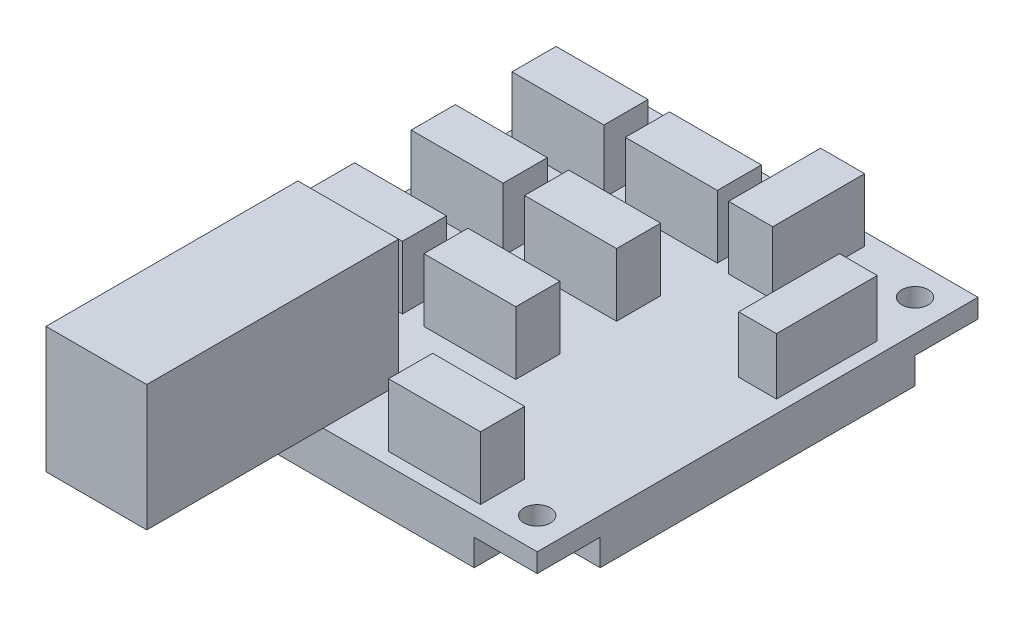
from build123d import *

# Parameters (mm, degrees)
SKETCH_1_W                       = 30
SKETCH_1_H                       = 35
EXTRUDE_1_DEPTH                  = 0.75
SKETCH_2_R                       = 1.05
CUT_EXTRUDE_1_DEPTH              = 1.5
EXTRUDE_2_DEPTH                  = 2.1
SKETCH_4_W                       = 3.5
SKETCH_4_H                       = 7.3
SKETCH_4_W_2                     = 7.3
SKETCH_4_H_2                     = 3.5
EXTRUDE_3_DEPTH                  = 5
SKETCH_5_W                       = 7.3
SKETCH_5_H                       = 3.5
EXTRUDE_4_DEPTH                  = 5
PATTERN_LINEAR_1_COUNT           = 2
PATTERN_LINEAR_1_PITCH           = 9
PATTERN_LINEAR_2_COUNT           = 3
PATTERN_LINEAR_2_PITCH           = 8
PATTERN_LINEAR_2_COPY_1_SKETCH_W = 7.3
PATTERN_LINEAR_2_COPY_1_SKETCH_H = 3.5
PATTERN_LINEAR_2_COPY_1_DEPTH    = 5
PATTERN_LINEAR_2_COPY_2_SKETCH_W = 7.3
PATTERN_LINEAR_2_COPY_2_SKETCH_H = 3.5
PATTERN_LINEAR_2_COPY_2_DEPTH    = 5
SKETCH_6_W                       = 3
SKETCH_6_H                       = 8
EXTRUDE_5_DEPTH                  = 4.5
SKETCH_7_W                       = 8
SKETCH_7_H                       = 20
EXTRUDE_6_DEPTH                  = 10


with BuildPart() as part:
    # ｽｹｯﾁ1 → ﾎﾞｽ - 押し出し1 (new, symmetric)
    with BuildSketch(Plane(origin=(0, 0, 0), x_dir=(1, 0, 0), z_dir=(0, 1, 0))):
        Rectangle(SKETCH_1_W, SKETCH_1_H)
    extrude(amount=EXTRUDE_1_DEPTH, both=True)

    # ｽｹｯﾁ2 → ｶｯﾄ - 押し出し1 (cut)
    with BuildSketch(Plane.XZ.offset(0.75)):
        with Locations(Location((-12.5, 15, 0), (0, 0, 270))):
            Circle(SKETCH_2_R)
        with Locations(Location((-12.5, -15, 0), (0, 0, 270))):
            Circle(SKETCH_2_R)
        with Locations(Location((12.5, 15, 0), (0, 0, 270))):
            Circle(SKETCH_2_R)
        with Locations(Location((12.5, -15, 0), (0, 0, 270))):
            Circle(SKETCH_2_R)
    extrude(amount=-CUT_EXTRUDE_1_DEPTH, mode=Mode.SUBTRACT)

    # ｽｹｯﾁ3 → ﾎﾞｽ - 押し出し2 (add)
    with BuildSketch(Plane.XZ.offset(0.75)):
        Polygon((-10, 17.5), (-10, 13.5), (-15, 13.5), (-15, -12.5), (-10, -12.5), (-10, -17.5), (10, -17.5), (10, -12.5), (15, -12.5), (15, 12.5), (10, 12.5), (10, 17.5), align=None)
    extrude(amount=EXTRUDE_2_DEPTH)

    # ｽｹｯﾁ4 → ﾎﾞｽ - 押し出し3 (add)
    with BuildSketch(Plane(origin=(0, 0.75, 0), x_dir=(1, 0, 0), z_dir=(0, 1, 0))):
        with Locations((5.25, 12.85)):
            Rectangle(SKETCH_4_W, SKETCH_4_H)
        with Locations((5.85, -14.75)):
            Rectangle(SKETCH_4_W_2, SKETCH_4_H_2)
    extrude(amount=EXTRUDE_3_DEPTH)

    # ｽｹｯﾁ5 → ﾎﾞｽ - 押し出し4 (add)
    with BuildSketch(Plane(origin=(0, 0.75, 0), x_dir=(1, 0, 0), z_dir=(0, 1, 0))):
        with Locations((-10.35, 11.25)):
            Rectangle(SKETCH_5_W, SKETCH_5_H)
    extrude_4 = extrude(amount=EXTRUDE_4_DEPTH)

    # 直線ﾊﾟﾀｰﾝ1: ﾎﾞｽ - 押し出し4 ×2
    with Locations(*[(i * PATTERN_LINEAR_1_PITCH, 0, 0) for i in range(1, PATTERN_LINEAR_1_COUNT)]):
        add(extrude_4)

    # 直線ﾊﾟﾀｰﾝ2: ﾎﾞｽ - 押し出し4 ×3
    with Locations(*[(0, 0, i * PATTERN_LINEAR_2_PITCH) for i in range(1, PATTERN_LINEAR_2_COUNT)]):
        add(extrude_4)

    # 直線ﾊﾟﾀｰﾝ2 copy 1 sketch → 直線ﾊﾟﾀｰﾝ2 copy 1 (add)
    with BuildSketch(Plane(origin=(9, 0.75, 8), x_dir=(1, 0, 0), z_dir=(0, 1, 0))):
        with Locations((-10.35, 11.25)):
            Rectangle(PATTERN_LINEAR_2_COPY_1_SKETCH_W, PATTERN_LINEAR_2_COPY_1_SKETCH_H)
    extrude(amount=PATTERN_LINEAR_2_COPY_1_DEPTH)

    # 直線ﾊﾟﾀｰﾝ2 copy 2 sketch → 直線ﾊﾟﾀｰﾝ2 copy 2 (add)
    with BuildSketch(Plane(origin=(9, 0.75, 16), x_dir=(1, 0, 0), z_dir=(0, 1, 0))):
        with Locations((-10.35, 11.25)):
            Rectangle(PATTERN_LINEAR_2_COPY_2_SKETCH_W, PATTERN_LINEAR_2_COPY_2_SKETCH_H)
    extrude(amount=PATTERN_LINEAR_2_COPY_2_DEPTH)

    # ｽｹｯﾁ6 → ﾎﾞｽ - 押し出し5 (add)
    with BuildSketch(Plane(origin=(0, 0.75, 0), x_dir=(1, 0, 0), z_dir=(0, 1, 0))):
        with Locations((12.5, 6.5)):
            Rectangle(SKETCH_6_W, SKETCH_6_H)
    extrude(amount=EXTRUDE_5_DEPTH)

    # ｽｹｯﾁ7 → ﾎﾞｽ - 押し出し6 (add)
    with BuildSketch(Plane(origin=(0, 0.75, 0), x_dir=(1, 0, 0), z_dir=(0, 1, 0))):
        with Locations((-6, -21.5)):
            Rectangle(SKETCH_7_W, SKETCH_7_H)
    extrude(amount=EXTRUDE_6_DEPTH)


solid = part.part
